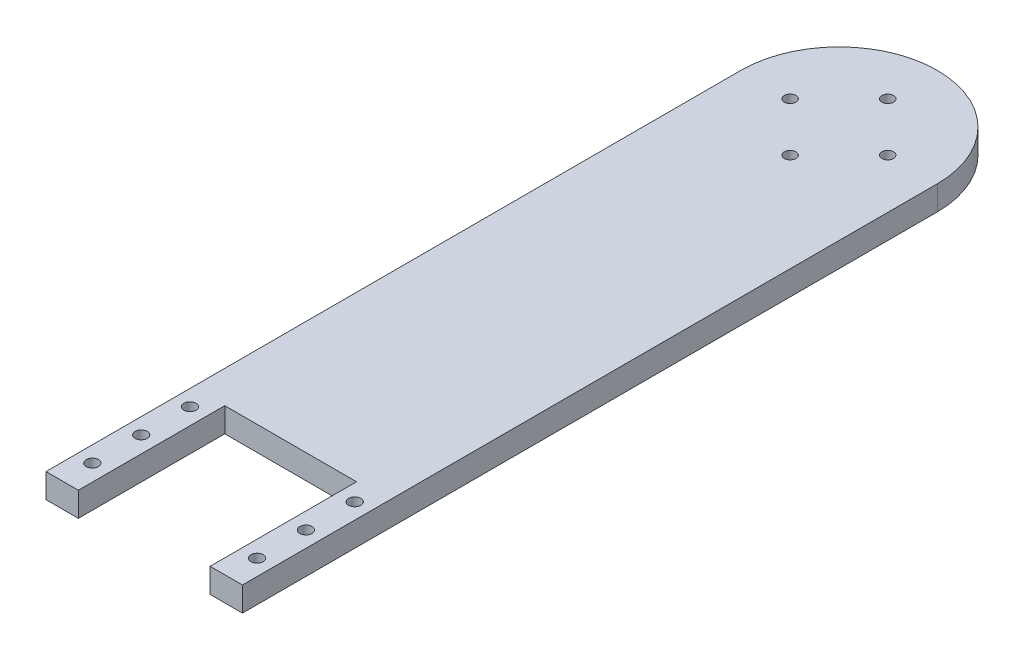
from build123d import *

# Parameters (mm, degrees)
BOSS_EXTRU_1_DEPTH      = 4
ESQUISSE2_R             = 0.955
ESQUISSE2_R_2           = 1
ENL_V_MAT_EXTRU_1_DEPTH = 4
ESQUISSE4_W             = 18
ESQUISSE4_H             = 24
ENL_V_MAT_EXTRU_2_DEPTH = 10
ESQUISSE5_W             = 2.116024011
ESQUISSE5_H             = 24
ESQUISSE5_W_2           = 1.483975989
ENL_V_MAT_EXTRU_3_DEPTH = 10


with BuildPart() as part:
    # Esquisse1 → Boss.-Extru.1 (new body)
    with BuildSketch(Plane(origin=(0, 0, 0), x_dir=(1, 0, 0), z_dir=(0, 1, 0))):
        with BuildLine():
            Line((-16.1, 0), (-16.1, -113.9))
            Line((-16.1, -113.9), (16.1, -113.9))
            Line((16.1, -113.9), (16.1, 0))
            ThreePointArc((16.1, 0), (0, 16.1), (-16.1, 0))
        make_face()
    extrude(amount=BOSS_EXTRU_1_DEPTH)

    # Esquisse2 → Enlèv. mat.-Extru.1 (cut)
    with BuildSketch(Plane(origin=(0, 4, 0), x_dir=(1, 0, 0), z_dir=(0, 1, 0))):
        with Locations(Location((7.975097556, -0.002271435, 0), (0, 0, 270))):
            Circle(ESQUISSE2_R)
        with Locations(Location((-8.024902444, -0.002271435, 0), (0, 0, 270))):
            Circle(ESQUISSE2_R)
        with Locations(Location((-0.024902444, -8.002271435, 0), (0, 0, 270))):
            Circle(ESQUISSE2_R)
        with Locations(Location((-0.024902444, 7.997728565, 0), (0, 0, 270))):
            Circle(ESQUISSE2_R)
        with Locations(Location((-13.5, -108.9, 0), (0, 0, 270))):
            Circle(ESQUISSE2_R_2)
        with Locations(Location((13.5, -108.9, 0), (0, 0, 270))):
            Circle(ESQUISSE2_R_2)
        with Locations(Location((-13.5, -100.9, 0), (0, 0, 270))):
            Circle(ESQUISSE2_R_2)
        with Locations(Location((13.5, -100.9, 0), (0, 0, 270))):
            Circle(ESQUISSE2_R_2)
        with Locations(Location((-13.5, -92.9, 0), (0, 0, 270))):
            Circle(ESQUISSE2_R_2)
        with Locations(Location((13.5, -92.9, 0), (0, 0, 270))):
            Circle(ESQUISSE2_R_2)
    extrude(amount=-ENL_V_MAT_EXTRU_1_DEPTH, mode=Mode.SUBTRACT)

    # Esquisse4 → Enlèv. mat.-Extru.2 (cut)
    with BuildSketch(Plane(origin=(0, 4, 0), x_dir=(1, 0, 0), z_dir=(0, 1, 0))):
        with Locations((0.316024011, -101.9)):
            Rectangle(ESQUISSE4_W, ESQUISSE4_H)
    extrude(amount=-ENL_V_MAT_EXTRU_2_DEPTH, mode=Mode.SUBTRACT)

    # Esquisse5 → Enlèv. mat.-Extru.3 (cut)
    with BuildSketch(Plane(origin=(0, 4, 0), x_dir=(1, 0, 0), z_dir=(0, 1, 0))):
        with Locations((-9.741987995, -101.9)):
            Rectangle(ESQUISSE5_W, ESQUISSE5_H)
        with Locations((10.058012006, -101.9)):
            Rectangle(ESQUISSE5_W_2, ESQUISSE5_H)
    extrude(amount=-ENL_V_MAT_EXTRU_3_DEPTH, mode=Mode.SUBTRACT)


solid = part.part
